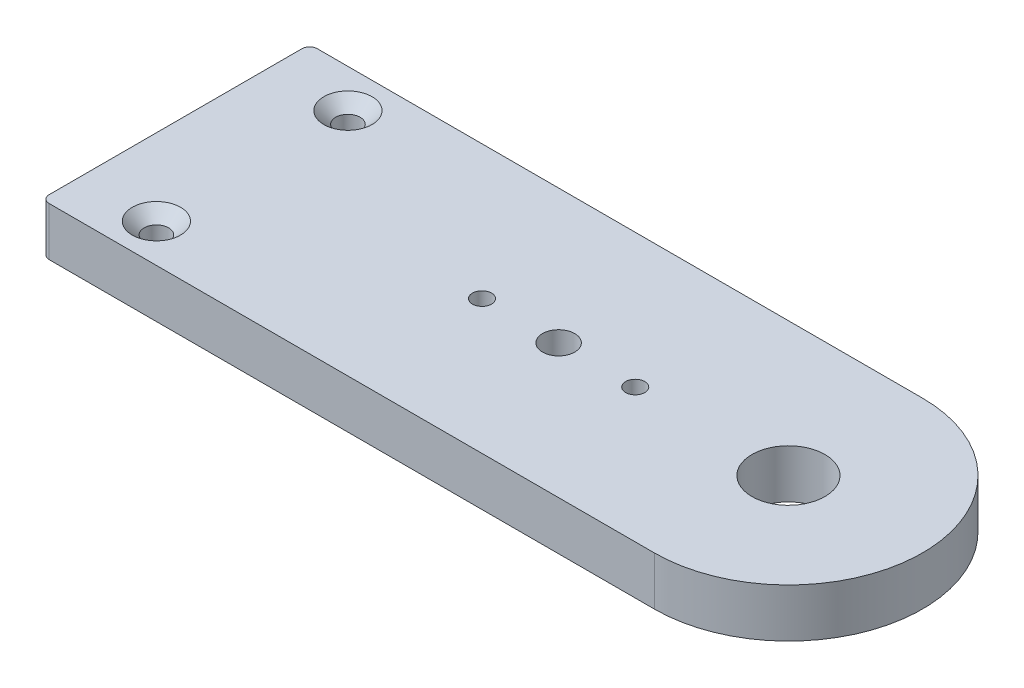
from build123d import *

# Parameters (mm, degrees)
SKETCH2_R                                       = 4.7625
BOSS_EXTRUDE1_DEPTH                             = 6.35
CSK_FOR_M3_FLAT_HEAD_MACHINE_SCREW1_D           = 3.2
CSK_FOR_M3_FLAT_HEAD_MACHINE_SCREW1_CSINK_D     = 6.3
CSK_FOR_M3_FLAT_HEAD_MACHINE_SCREW1_CSINK_ANGLE = 90
TAP_DRILL_FOR_M3X0_5_TAP1_D                     = 2.5
FILLET1_R                                       = 1
TAP_DRILL_FOR_M5X0_8_TAP1_D                     = 4.2


with BuildPart() as part:
    # Sketch2 → Boss-Extrude1 (new body)
    with BuildSketch(Plane(origin=(0, 0, 0), x_dir=(1, 0, 0), z_dir=(0, 1, 0))):
        with BuildLine():
            Line((70, 17.5), (-10, 17.5))
            Line((-10, 17.5), (-10, -17.5))
            Line((-10, -17.5), (70, -17.5))
            ThreePointArc((70, -17.5), (87.5, 0), (70, 17.5))
        make_face()
        with Locations((70, 0)):
            Circle(SKETCH2_R, mode=Mode.SUBTRACT)
    extrude(amount=-BOSS_EXTRUDE1_DEPTH)

    # CSK for M3 Flat Head Machine Screw1 (through all)
    with Locations(Plane(origin=(0, 0, -12.5), x_dir=(0, 0, 1), z_dir=(0, 1, 0))):
        with Locations((0, 0), (25, 0)):
            CounterSinkHole(CSK_FOR_M3_FLAT_HEAD_MACHINE_SCREW1_D / 2, CSK_FOR_M3_FLAT_HEAD_MACHINE_SCREW1_CSINK_D / 2, counter_sink_angle=CSK_FOR_M3_FLAT_HEAD_MACHINE_SCREW1_CSINK_ANGLE)

    # Tap Drill for M3x0.5 Tap1 (through all)
    with Locations(Plane(origin=(30, 0, 0), x_dir=(0, 0, 1), z_dir=(0, 1, 0))):
        with Locations((0, 0), (0, 20)):
            Hole(TAP_DRILL_FOR_M3X0_5_TAP1_D / 2)

    # Fillet1
    fillet1_edges = [part.edges().sort_by_distance(p)[0] for p in [
        (-10, -3.175, 17.5),
        (-10, -3.175, -17.5),
    ]]
    fillet(fillet1_edges, radius=FILLET1_R)

    # Tap Drill for M5x0.8 Tap1 (through all)
    with Locations(Plane(origin=(40, 0, 0), x_dir=(0, 0, 1), z_dir=(0, 1, 0))):
        with Locations((0, 0)):
            Hole(TAP_DRILL_FOR_M5X0_8_TAP1_D / 2)


solid = part.part
